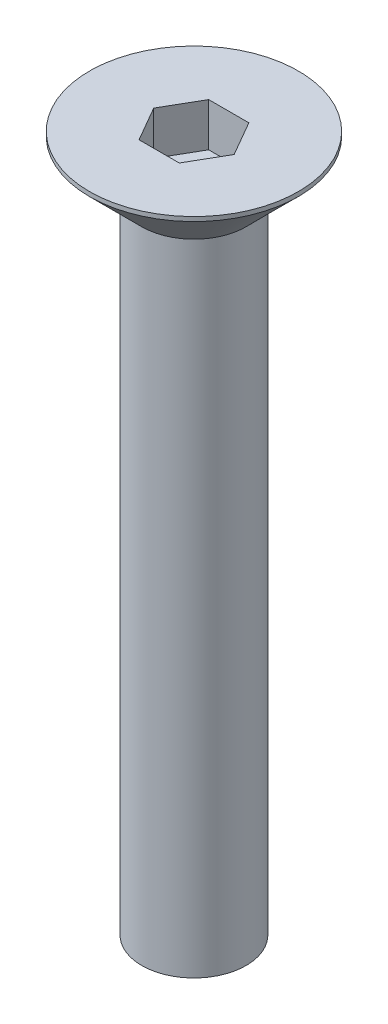
from build123d import *

# Parameters (mm, degrees)
CUT_EXTRUDE1_DEPTH = 5


with BuildPart() as part:
    # Sketch1 → Revolve1 (revolve)
    with BuildSketch(Plane.XY, mode=Mode.PRIVATE) as revolve1_sk:
        Polygon((0, -80), (6, -80), (6, -6.5), (12, -0.5), (12, 0), (0, 0), align=None)
    revolve(revolve1_sk.sketch.rotate(Axis((0, 61.691642626, 0), (0, -1, 0)), 90), axis=Axis((0, 61.691642626, 0), (0, -1, 0)))

    # Sketch2 → Cut-Extrude1 (cut)
    with BuildSketch(Plane(origin=(0, 0, 0), x_dir=(-1, 0, 0), z_dir=(0, 1, 0))):
        Polygon((-2.309401077, -4), (2.309401077, -4), (4.618802154, 0), (2.309401077, 4), (-2.309401077, 4), (-4.618802154, 0), align=None)
    extrude(amount=-CUT_EXTRUDE1_DEPTH, mode=Mode.SUBTRACT)


solid = part.part
